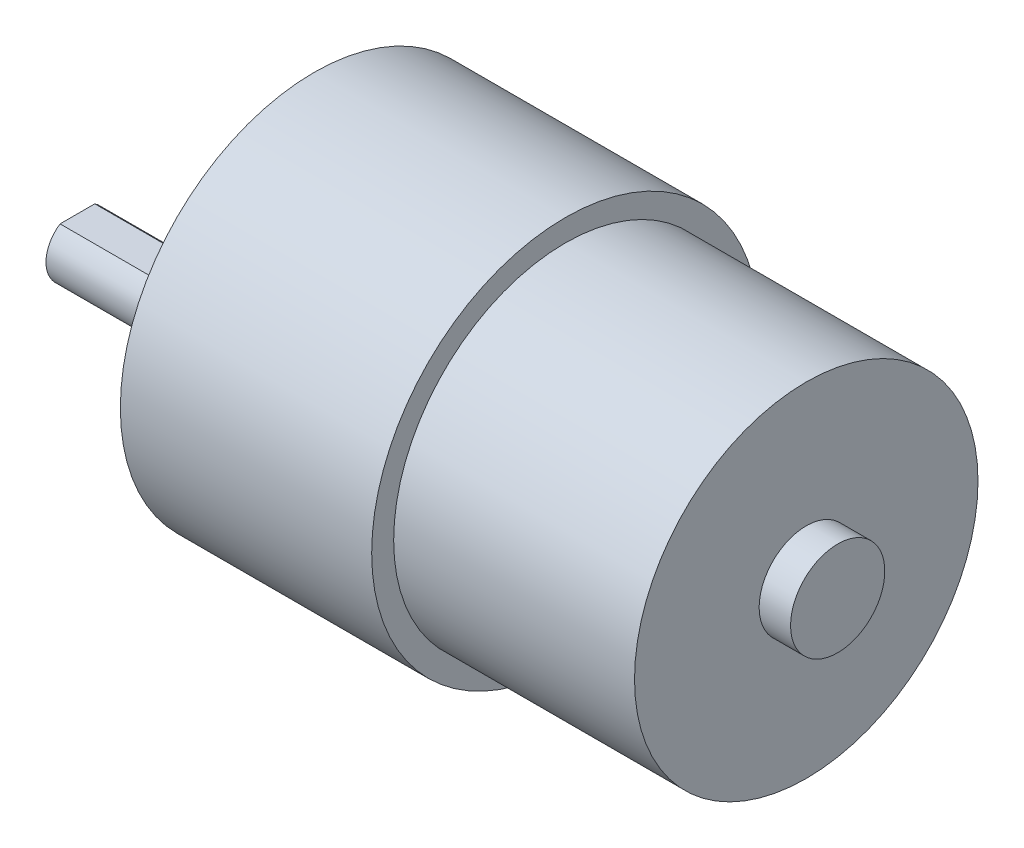
from build123d import *

# Parameters (mm, degrees)
F_1_5MM_DOWEL_HOLE1_D     = 1.5
F_1_5MM_DOWEL_HOLE1_DEPTH = 10
F_1_5MM_DOWEL_HOLE1_TIP   = 0.450645464
SKETCH3_R                 = 6
BOSS_EXTRUDE1_DEPTH       = 4.6
SKETCH7_R                 = 3
BOSS_EXTRUDE2_DEPTH       = 6
BOSS_EXTRUDE3_DEPTH       = 12


with BuildPart() as part:
    # Sketch2 one side → Revolve1 (revolve)
    with BuildSketch(Plane.XY):
        Polygon((24, 37), (0, 37), (0, 18.5), (50, 18.5), (50, 23), (47, 23), (47, 34.9), (24, 34.9), align=None)
    revolve(axis=Axis((0, 18.5, 0), (1, 0, 0)))

    # Sketch2<3> one side → Revolve2 (revolve)
    with BuildSketch(Plane.XY):
        Polygon((24, 37), (0, 37), (0, 18.5), (50, 18.5), (50, 23), (47, 23), (47, 34.9), (24, 34.9), align=None)
    revolve(axis=Axis((0, 18.5, 0), (1, 0, 0)))

    # Ø1.5mm Dowel Hole1
    with Locations(Plane.ZY):
        with Locations((-7.75, 31.923393759), (-15.5, 18.5), (-7.75, 5.076606241), (15.5, 18.5)):
            Hole(F_1_5MM_DOWEL_HOLE1_D / 2, depth=F_1_5MM_DOWEL_HOLE1_DEPTH)
            with Locations((0, 0, -(F_1_5MM_DOWEL_HOLE1_DEPTH + F_1_5MM_DOWEL_HOLE1_TIP / 2))):  # 118° drill point
                Cone(0, F_1_5MM_DOWEL_HOLE1_D / 2, F_1_5MM_DOWEL_HOLE1_TIP, mode=Mode.SUBTRACT)

    # Sketch3 → Boss-Extrude1 (add)
    with BuildSketch(Plane.ZY):
        with Locations((0, 11.5)):
            Circle(SKETCH3_R)
    extrude(amount=BOSS_EXTRUDE1_DEPTH)

    # Sketch7 → Boss-Extrude2 (add)
    with BuildSketch(Plane.ZY.offset(4.6)):
        with Locations((0, 11.5)):
            Circle(SKETCH7_R)
    extrude(amount=BOSS_EXTRUDE2_DEPTH)

    # Sketch8 → Boss-Extrude3 (add)
    with BuildSketch(Plane.ZY.offset(10.6)):
        with BuildLine():
            Line((-1.658312395, 14), (1.658312395, 14))
            ThreePointArc((1.658312395, 14), (0, 8.5), (-1.658312395, 14))
        make_face()
    extrude(amount=BOSS_EXTRUDE3_DEPTH)


solid = part.part
